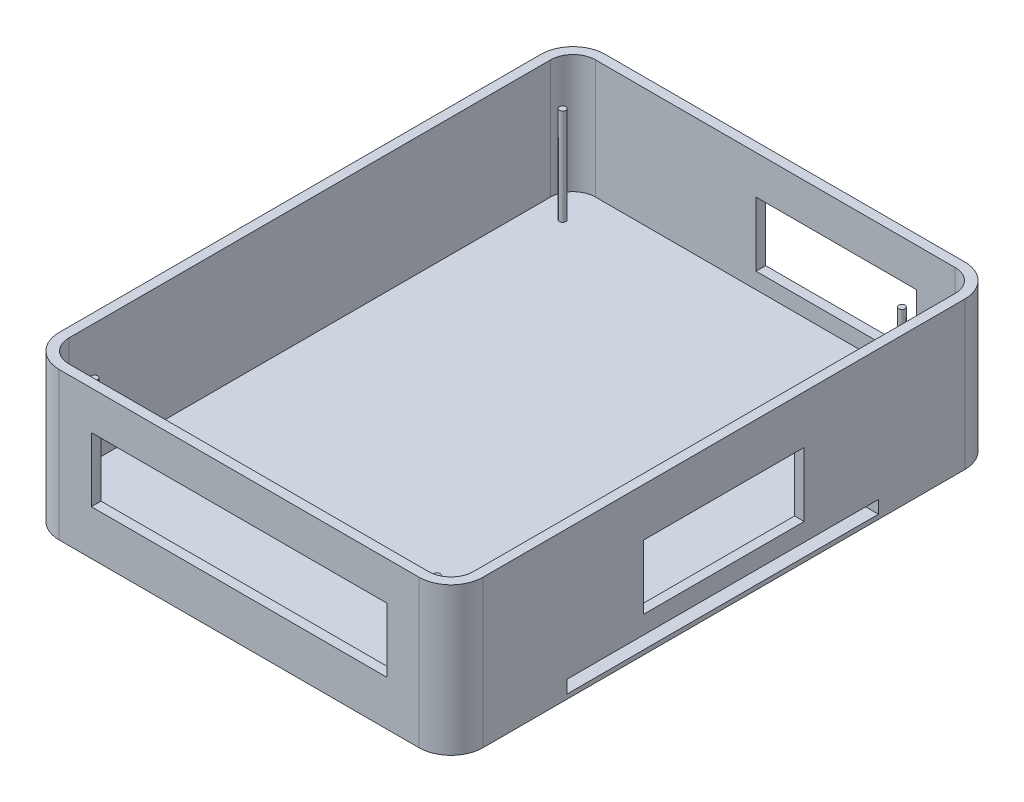
from build123d import *

# Parameters (mm, degrees)
SCHIZZO1_W                   = 66
SCHIZZO1_H                   = 85
ESTRUSIONE_ESTRUSIONE1_DEPTH = 20
RACCORDO1_R                  = 5
RACCORDO2_R                  = 5
RACCORDO3_R                  = 5
SVUOTA2_T                    = -1.5
SCHIZZO3_R                   = 0.5
ESTRUSIONE_ESTRUSIONE2_DEPTH = 15
SCHIZZO6_R                   = 0.5
ESTRUSIONE_ESTRUSIONE3_DEPTH = 15
SCHIZZO13_W                  = 25
SCHIZZO13_H                  = 10
TAGLIO_ESTRUSIONE2_DEPTH     = 2
SCHIZZO19_W                  = 46
SCHIZZO19_H                  = 10
TAGLIO_ESTRUSIONE5_DEPTH     = 2
ESTRUSIONE_ESTRUSIONE4_DEPTH = 3
SCHIZZO18_W                  = 48.51759383
SCHIZZO18_H                  = 2
TAGLIO_ESTRUSIONE6_DEPTH     = 80
SCHIZZO22_W                  = 25
SCHIZZO22_H                  = 10
TAGLIO_ESTRUSIONE7_DEPTH     = 2


with BuildPart() as part:
    # Schizzo1 → Estrusione-Estrusione1 (new body)
    with BuildSketch(Plane(origin=(0, 0, 0), x_dir=(1, 0, 0), z_dir=(0, 1, 0))):
        with Locations((33, 42.5)):
            Rectangle(SCHIZZO1_W, SCHIZZO1_H)
    extrude(amount=ESTRUSIONE_ESTRUSIONE1_DEPTH)

    # Raccordo1
    raccordo1_edges = [part.edges().sort_by_distance(p)[0] for p in [
        (66, 10, 0),
        (0, 10, 0),
    ]]
    fillet(raccordo1_edges, radius=RACCORDO1_R)

    # Raccordo2
    raccordo2_edges = [part.edges().sort_by_distance(p)[0] for p in [
        (66, 10, -85),
    ]]
    fillet(raccordo2_edges, radius=RACCORDO2_R)

    # Raccordo3
    raccordo3_edges = [part.edges().sort_by_distance(p)[0] for p in [
        (0, 10, -85),
    ]]
    fillet(raccordo3_edges, radius=RACCORDO3_R)

    # Svuota2
    svuota2_openings = [part.faces().sort_by_distance(p)[0] for p in [
        (33, 20, -42.5),
    ]]
    offset(amount=SVUOTA2_T, openings=svuota2_openings, kind=Kind.INTERSECTION)

    # Schizzo3 → Estrusione-Estrusione2 (add)
    with BuildSketch(Plane(origin=(0, 1.5, 0), x_dir=(1, 0, 0), z_dir=(0, 1, 0))):
        with Locations(Location((5.5, 77.89, 0), (0, 0, 90))):
            Circle(SCHIZZO3_R)
    extrude(amount=ESTRUSIONE_ESTRUSIONE2_DEPTH)

    # Schizzo6 → Estrusione-Estrusione3 (add)
    with BuildSketch(Plane(origin=(0, 1.5, 0), x_dir=(1, 0, 0), z_dir=(0, 1, 0))):
        with Locations(Location((58.664950896, 77.535960271, 0), (0, 0, 90))):
            Circle(SCHIZZO6_R)
        with Locations(Location((58.664950896, 5.132828607, 0), (0, 0, 90))):
            Circle(SCHIZZO6_R)
        with Locations(Location((5.345748971, 5.132828607, 0), (0, 0, 90))):
            Circle(SCHIZZO6_R)
    extrude(amount=ESTRUSIONE_ESTRUSIONE3_DEPTH)

    # Schizzo13 → Taglio-Estrusione2 (cut)
    with BuildSketch(Plane(origin=(0, 0, -85), x_dir=(-1, 0, 0), z_dir=(0, 0, -1))):
        with Locations((-42.5, 9)):
            Rectangle(SCHIZZO13_W, SCHIZZO13_H)
    extrude(amount=-TAGLIO_ESTRUSIONE2_DEPTH, mode=Mode.SUBTRACT)

    # Schizzo19 → Taglio-Estrusione5 (cut)
    with BuildSketch(Plane.XY):
        with Locations((33, 9)):
            Rectangle(SCHIZZO19_W, SCHIZZO19_H)
    extrude(amount=-TAGLIO_ESTRUSIONE5_DEPTH, mode=Mode.SUBTRACT)

    # Schizzo21 → Estrusione-Estrusione4 (add)
    with BuildSketch(Plane.XZ):
        with BuildLine():
            Line((5, 0), (61, 0))
            ThreePointArc((61, 0), (64.535533906, -1.464466094), (66, -5))
            Line((66, -5), (66, -80))
            ThreePointArc((66, -80), (64.535533906, -83.535533906), (61, -85))
            Line((61, -85), (5, -85))
            ThreePointArc((5, -85), (1.464466094, -83.535533906), (0, -80))
            Line((0, -80), (0, -5))
            ThreePointArc((0, -5), (1.464466094, -1.464466094), (5, 0))
        make_face()
    extrude(amount=ESTRUSIONE_ESTRUSIONE4_DEPTH)

    # Schizzo18 → Taglio-Estrusione6 (cut)
    with BuildSketch(Plane.ZY):
        with Locations((-42.307961204, -1.3)):
            Rectangle(SCHIZZO18_W, SCHIZZO18_H)
    extrude(amount=-TAGLIO_ESTRUSIONE6_DEPTH, mode=Mode.SUBTRACT)

    # Schizzo22 → Taglio-Estrusione7 (cut)
    with BuildSketch(Plane(origin=(66, 0, 0), x_dir=(0, 0, -1), z_dir=(1, 0, 0))):
        with Locations((42.5, 7.5)):
            Rectangle(SCHIZZO22_W, SCHIZZO22_H)
    extrude(amount=-TAGLIO_ESTRUSIONE7_DEPTH, mode=Mode.SUBTRACT)


solid = part.part
